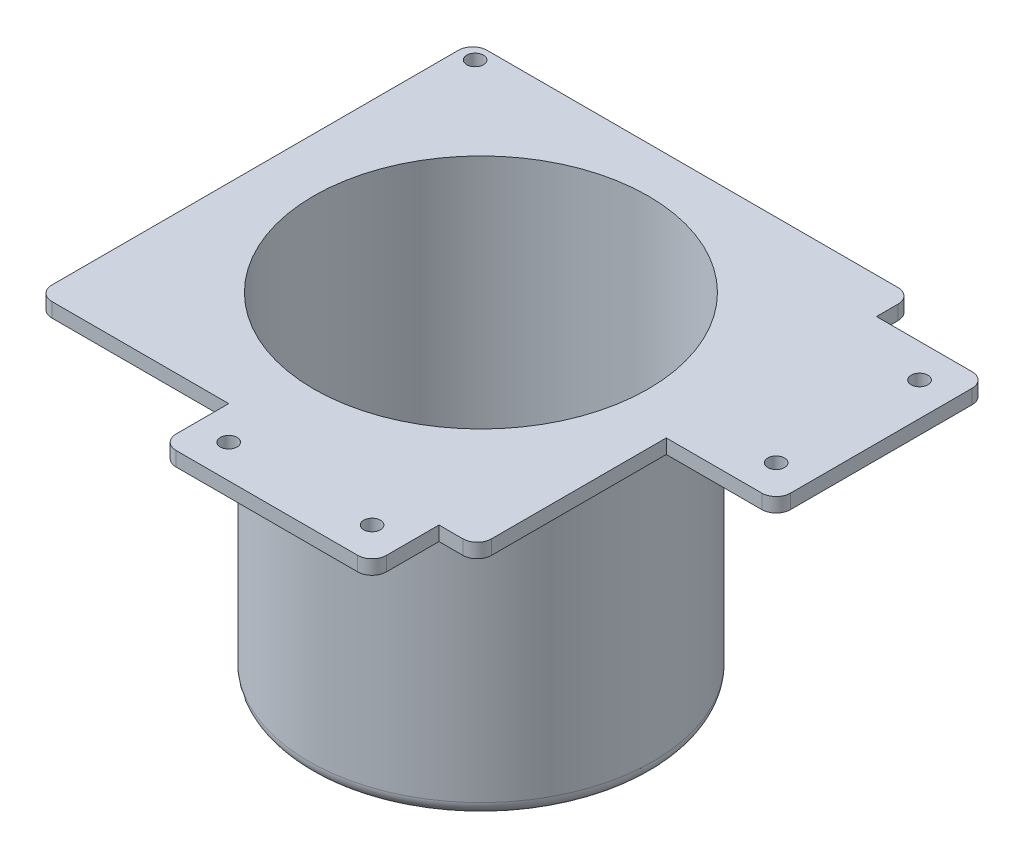
from build123d import *

# Parameters (mm, degrees)
ESQUISSE1_R        = 1.75
BOSS_EXTRU_1_DEPTH = 3
ESQUISSE2_R        = 36
BOSS_EXTRU_4_DEPTH = 0.5
ESQUISSE5_R        = 36
ESQUISSE5_R_2      = 35
BOSS_EXTRU_6_DEPTH = 68
ESQUISSE6_R        = 36
BOSS_EXTRU_7_DEPTH = 2
CONG_7_R           = 3
CONG_8_R           = 3
CONG_9_R           = 3
CONG_10_R          = 3
CONG_11_R          = 3
CONG_12_R          = 3
CONG_13_R          = 3
CONG_15_R          = 3
CONG_16_R          = 3
ESQUISSE7_R        = 36.000000001
BOSS_EXTRU_9_DEPTH = 2.5


with BuildPart() as part:
    # Esquisse1 → Boss.-Extru.1 (new body)
    with BuildSketch(Plane(origin=(0, 0, 0), x_dir=(1, 0, 0), z_dir=(0, 1, 0))):
        Polygon((0, 91.06), (0, 0), (40, 0), (40, -14), (84, -14), (84, 0), (92, 0), (92, 39.56), (115, 39.56), (115, 83.56), (92, 83.56), (92, 91.06), align=None)
        with Locations(Location((108, 46.56, 0), (0, 0, 270))):
            Circle(ESQUISSE1_R, mode=Mode.SUBTRACT)
        with Locations(Location((108, 76.56, 0), (0, 0, 270))):
            Circle(ESQUISSE1_R, mode=Mode.SUBTRACT)
        with Locations(Location((3.5, 88.06, 0), (0, 0, 270))):
            Circle(ESQUISSE1_R, mode=Mode.SUBTRACT)
        with Locations(Location((77, -7, 0), (0, 0, 270))):
            Circle(ESQUISSE1_R, mode=Mode.SUBTRACT)
        with Locations(Location((47, -7, 0), (0, 0, 270))):
            Circle(ESQUISSE1_R, mode=Mode.SUBTRACT)
        Polygon((11.27, 87.06), (88, 87.06), (88, 6), (4.5, 6), (4.5, 73.06), (11.27, 73.06), align=None, mode=Mode.SUBTRACT)
    extrude(amount=-BOSS_EXTRU_1_DEPTH)

    # Esquisse2 → Boss.-Extru.4 (add)
    with BuildSketch(Plane(origin=(0, 0, 0), x_dir=(1, 0, 0), z_dir=(0, 1, 0))):
        Polygon((11.27, 73.06), (4.5, 73.06), (4.5, 6), (88, 6), (88, 87.06), (11.27, 87.06), align=None)
        with Locations(Location((46.25, 46.53, 0), (0, 0, 270))):
            Circle(ESQUISSE2_R, mode=Mode.SUBTRACT)
    extrude(amount=-BOSS_EXTRU_4_DEPTH)

    # Esquisse5 → Boss.-Extru.6 (add)
    with BuildSketch(Plane(origin=(0, 0, 0), x_dir=(1, 0, 0), z_dir=(0, 1, 0))):
        with Locations(Location((46.25, 46.53, 0), (0, 0, 270))):
            Circle(ESQUISSE5_R)
        with Locations(Location((46.25, 46.53, 0), (0, 0, 270))):
            Circle(ESQUISSE5_R_2, mode=Mode.SUBTRACT)
    extrude(amount=-BOSS_EXTRU_6_DEPTH)

    # Esquisse6 → Boss.-Extru.7 (add)
    with BuildSketch(Plane.XZ.offset(68)):
        with Locations(Location((46.25, -46.53, 0), (0, 0, 270))):
            Circle(ESQUISSE6_R)
    extrude(amount=BOSS_EXTRU_7_DEPTH)

    # Congé7
    cong_7_edges = [part.edges().sort_by_distance(p)[0] for p in [
        (0, -1.5, -91.06),
    ]]
    fillet(cong_7_edges, radius=CONG_7_R)

    # Congé8
    cong_8_edges = [part.edges().sort_by_distance(p)[0] for p in [
        (40, -1.5, 14),
    ]]
    fillet(cong_8_edges, radius=CONG_8_R)

    # Congé9
    cong_9_edges = [part.edges().sort_by_distance(p)[0] for p in [
        (0, -1.5, 0),
    ]]
    fillet(cong_9_edges, radius=CONG_9_R)

    # Congé10
    cong_10_edges = [part.edges().sort_by_distance(p)[0] for p in [
        (92, -1.5, 0),
    ]]
    fillet(cong_10_edges, radius=CONG_10_R)

    # Congé11
    cong_11_edges = [part.edges().sort_by_distance(p)[0] for p in [
        (84, -1.5, 14),
    ]]
    fillet(cong_11_edges, radius=CONG_11_R)

    # Congé12
    cong_12_edges = [part.edges().sort_by_distance(p)[0] for p in [
        (115, -1.5, -39.56),
    ]]
    fillet(cong_12_edges, radius=CONG_12_R)

    # Congé13
    cong_13_edges = [part.edges().sort_by_distance(p)[0] for p in [
        (115, -1.5, -83.56),
    ]]
    fillet(cong_13_edges, radius=CONG_13_R)

    # Congé15
    cong_15_edges = [part.edges().sort_by_distance(p)[0] for p in [
        (92, -1.5, -91.06),
    ]]
    fillet(cong_15_edges, radius=CONG_15_R)

    # Congé16
    cong_16_edges = [part.edges().sort_by_distance(p)[0] for p in [
        (46.25, -70, -10.53),
    ]]
    fillet(cong_16_edges, radius=CONG_16_R)

    # Esquisse7 → Boss.-Extru.9 (add)
    with BuildSketch(Plane.XZ.offset(0.5)):
        Polygon((4.5, -6), (88, -6), (88, -87.06), (11.27, -87.06), (11.27, -73.06), (4.5, -73.06), align=None)
        with Locations(Location((46.25, -46.53, 0), (0, 0, 270))):
            Circle(ESQUISSE7_R, mode=Mode.SUBTRACT)
    extrude(amount=BOSS_EXTRU_9_DEPTH)


solid = part.part
